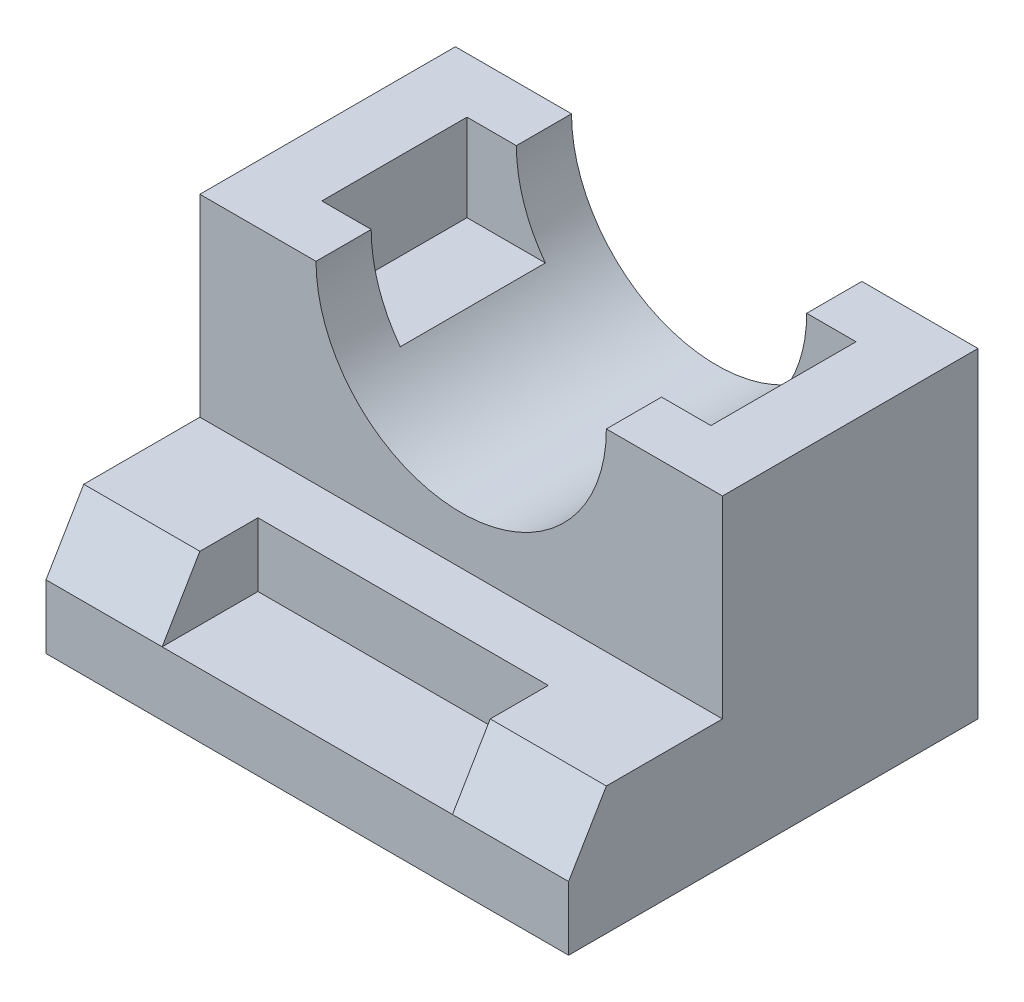
from build123d import *

# Parameters (mm, degrees)
SKETCH1_W           = 1117.6
SKETCH1_H           = 1403.35
BOSS_EXTRUDE1_DEPTH = 2286
SKETCH2_W           = 2286
SKETCH2_H           = 558.8
BOSS_EXTRUDE2_DEPTH = 673.1
CUT_EXTRUDE1_DEPTH  = 2286
SKETCH7_W           = 1270
SKETCH7_H           = 279.4
CUT_EXTRUDE2_DEPTH  = 673.1
SKETCH8_W           = 1270
SKETCH8_H           = 279.4
BOSS_EXTRUDE3_DEPTH = 254
CUT_EXTRUDE3_DEPTH  = 1117.6
SKETCH10_W          = 381
SKETCH10_H          = 635
CUT_EXTRUDE4_DEPTH  = 381


with BuildPart() as part:
    # Sketch1 → Boss-Extrude1 (new body)
    with BuildSketch(Plane(origin=(0, 0, 0), x_dir=(0, 0, -1), z_dir=(1, 0, 0))):
        with Locations((558.8, 701.675)):
            Rectangle(SKETCH1_W, SKETCH1_H)
    extrude(amount=BOSS_EXTRUDE1_DEPTH)

    # Sketch2 → Boss-Extrude2 (add)
    with BuildSketch(Plane.XY):
        with Locations((1143, 279.4)):
            Rectangle(SKETCH2_W, SKETCH2_H)
    extrude(amount=BOSS_EXTRUDE2_DEPTH)

    # Sketch3 → Cut-Extrude1 (cut)
    with BuildSketch(Plane.ZY):
        Polygon((508, 558.8), (673.1, 279.4), (673.1, 558.8), align=None)
    extrude(amount=-CUT_EXTRUDE1_DEPTH, mode=Mode.SUBTRACT)

    # Sketch7 → Cut-Extrude2 (cut)
    with BuildSketch(Plane.XY):
        with Locations((1143, 419.1)):
            Rectangle(SKETCH7_W, SKETCH7_H)
    extrude(amount=CUT_EXTRUDE2_DEPTH, mode=Mode.SUBTRACT)

    # Sketch8 → Boss-Extrude3 (add)
    with BuildSketch(Plane.XY):
        with Locations((1143, 419.1)):
            Rectangle(SKETCH8_W, SKETCH8_H)
    extrude(amount=BOSS_EXTRUDE3_DEPTH)

    # Sketch9 → Cut-Extrude3 (cut)
    with BuildSketch(Plane.XY):
        with BuildLine():
            Line((508, 1403.35), (1778, 1403.35))
            ThreePointArc((1778, 1403.35), (1143, 768.35), (508, 1403.35))
        make_face()
    extrude(amount=-CUT_EXTRUDE3_DEPTH, mode=Mode.SUBTRACT)

    # Sketch10 → Cut-Extrude4 (cut)
    with BuildSketch(Plane(origin=(0, 1403.35, 0), x_dir=(1, 0, 0), z_dir=(0, 1, 0))):
        with Locations((482.6, 558.8)):
            Rectangle(SKETCH10_W, SKETCH10_H)
        with Locations((1803.4, 558.8)):
            Rectangle(SKETCH10_W, SKETCH10_H)
    extrude(amount=-CUT_EXTRUDE4_DEPTH, mode=Mode.SUBTRACT)


solid = part.part
